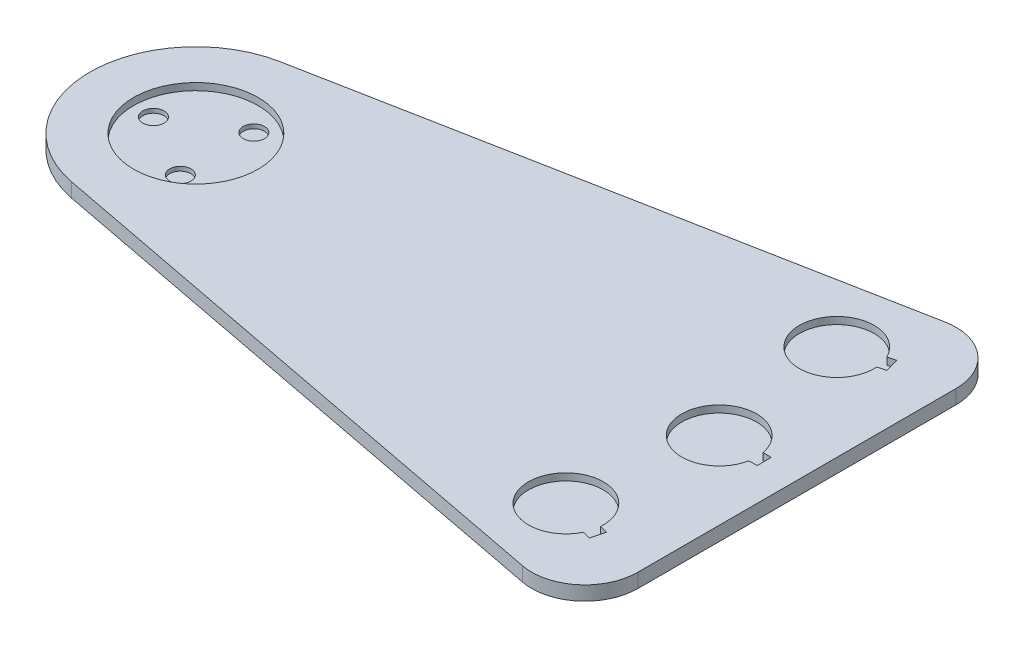
from build123d import *

# Parameters (mm, degrees)
IZIM2_W                        = 500
IZIM2_H                        = 300
Y_KSEKLIK_EKSTR_ZYON2_DEPTH    = 10
IZIM3_OUTSIDE_W                = 618.636
IZIM3_OUTSIDE_H                = 418.636
KES_EKSTR_ZYON1_DEPTH          = 10
TABAKLARI_UZAKLASTIRMA_2_DEPTH = 5
DAIRESEL_KAPLAMA1_COUNT        = 2
DAIRESEL_KAPLAMA1_ANGLE        = 15
AYNALAMA1_COPY_1_DEPTH         = 5
AYNALAMA1_COPY_2_DEPTH         = 5
IZIM9_R                        = 7.5
KES_EKSTR_ZYON4_DEPTH          = 8
DAIRESEL_KAPLAMA2_COUNT        = 3
IZIM10_R                       = 44
KES_EKSTR_ZYON5_DEPTH          = 5


with BuildPart() as part:
    # Çizim2 → Yükseklik-Ekstrüzyon2 (new body)
    with BuildSketch(Plane(origin=(0, 0, 0), x_dir=(1, 0, 0), z_dir=(0, 1, 0))):
        Rectangle(IZIM2_W, IZIM2_H)
    extrude(amount=Y_KSEKLIK_EKSTR_ZYON2_DEPTH)

    # Çizim3 outside → Kes-Ekstrüzyon1 (cut)
    with BuildSketch(Plane(origin=(0, 10, 0), x_dir=(1, 0, 0), z_dir=(0, 1, 0))):
        Rectangle(IZIM3_OUTSIDE_W, IZIM3_OUTSIDE_H)
        with BuildLine():
            Line((-189.1264052, 73.65761791), (205.4367974, 149.328808955))
            ThreePointArc((205.4367974, 149.328808955), (236.389117842, 141.406055572), (250, 112.5))
            Line((250, 112.5), (250, -112.5))
            ThreePointArc((250, -112.5), (236.389117842, -141.406055572), (205.4367974, -149.328808955))
            Line((205.4367974, -149.328808955), (-189.1264052, -73.65761791))
            ThreePointArc((-189.1264052, -73.65761791), (-250, 0), (-189.1264052, 73.65761791))
        make_face(mode=Mode.SUBTRACT)
    extrude(amount=-KES_EKSTR_ZYON1_DEPTH, mode=Mode.SUBTRACT)

    # Çizim6 → Tabaklari-uzaklastirma-2 (cut)
    with BuildSketch(Plane(origin=(0, 10, 0), x_dir=(1, 0, 0), z_dir=(0, 1, 0))):
        with BuildLine():
            Line((226.85, 5), (220.983294633, 5))
            ThreePointArc((220.983294633, 5), (221.340554056, 2.511336696), (221.46, 0))
            ThreePointArc((221.46, 0), (221.340554056, -2.511336696), (220.983294633, -5))
            Line((220.983294633, -5), (226.85, -5))
            Line((226.85, -5), (226.85, 5))
        make_face()
        with BuildLine():
            Line((206.85, -5), (206.85, 5))
            Line((206.85, 5), (220.983294633, 5))
            ThreePointArc((220.983294633, 5), (168.54, 0), (220.983294633, -5))
            Line((220.983294633, -5), (206.85, -5))
        make_face()
        with BuildLine():
            Line((220.983294633, 5), (206.85, 5))
            Line((206.85, 5), (206.85, -5))
            Line((206.85, -5), (220.983294633, -5))
            ThreePointArc((220.983294633, -5), (221.340554056, -2.511336696), (221.46, 0))
            ThreePointArc((221.46, 0), (221.340554056, 2.511336696), (220.983294633, 5))
        make_face()
    tabaklari_uzaklastirma_2 = extrude(amount=-TABAKLARI_UZAKLASTIRMA_2_DEPTH, mode=Mode.SUBTRACT)

    # Dairesel Kaplama1: Tabaklari-uzaklastirma-2 ×2 about axis
    dairesel_kaplama1_axis = Axis((-175, 0, 0), (0, 1, 0))
    for i in range(1, DAIRESEL_KAPLAMA1_COUNT):
        add(tabaklari_uzaklastirma_2.rotate(dairesel_kaplama1_axis, i * DAIRESEL_KAPLAMA1_ANGLE / (DAIRESEL_KAPLAMA1_COUNT - 1)), mode=Mode.SUBTRACT)

    # Aynalama1 copy 1 sketch → Aynalama1 copy 1 (cut)
    with BuildSketch(Plane(origin=(-5.962980399, 10, 45.293332893), x_dir=(0.9659258262890681, 0, 0.2588190451025214), z_dir=(0, 1, 0))):
        with BuildLine():
            Line((226.85, -5), (220.983294633, -5))
            ThreePointArc((220.983294633, -5), (221.340554056, -2.511336696), (221.46, 0))
            ThreePointArc((221.46, 0), (221.340554056, 2.511336696), (220.983294633, 5))
            Line((220.983294633, 5), (226.85, 5))
            Line((226.85, 5), (226.85, -5))
        make_face()
        with BuildLine():
            Line((206.85, 5), (206.85, -5))
            Line((206.85, -5), (220.983294633, -5))
            ThreePointArc((220.983294633, -5), (168.54, 0), (220.983294633, 5))
            Line((220.983294633, 5), (206.85, 5))
        make_face()
        with BuildLine():
            Line((220.983294633, -5), (206.85, -5))
            Line((206.85, -5), (206.85, 5))
            Line((206.85, 5), (220.983294633, 5))
            ThreePointArc((220.983294633, 5), (221.340554056, 2.511336696), (221.46, 0))
            ThreePointArc((221.46, 0), (221.340554056, -2.511336696), (220.983294633, -5))
        make_face()
    extrude(amount=-AYNALAMA1_COPY_1_DEPTH, mode=Mode.SUBTRACT)

    # Aynalama1 copy 2 sketch → Aynalama1 copy 2 (cut)
    with BuildSketch(Plane(origin=(0, 10, 0), x_dir=(1, 0, 0), z_dir=(0, 1, 0))):
        with BuildLine():
            Line((226.85, -5), (220.983294633, -5))
            ThreePointArc((220.983294633, -5), (221.340554056, -2.511336696), (221.46, 0))
            ThreePointArc((221.46, 0), (221.340554056, 2.511336696), (220.983294633, 5))
            Line((220.983294633, 5), (226.85, 5))
            Line((226.85, 5), (226.85, -5))
        make_face()
        with BuildLine():
            Line((206.85, 5), (206.85, -5))
            Line((206.85, -5), (220.983294633, -5))
            ThreePointArc((220.983294633, -5), (168.54, 0), (220.983294633, 5))
            Line((220.983294633, 5), (206.85, 5))
        make_face()
        with BuildLine():
            Line((220.983294633, -5), (206.85, -5))
            Line((206.85, -5), (206.85, 5))
            Line((206.85, 5), (220.983294633, 5))
            ThreePointArc((220.983294633, 5), (221.340554056, 2.511336696), (221.46, 0))
            ThreePointArc((221.46, 0), (221.340554056, -2.511336696), (220.983294633, -5))
        make_face()
    extrude(amount=-AYNALAMA1_COPY_2_DEPTH, mode=Mode.SUBTRACT)

    # Çizim9 → Kes-Ekstrüzyon4 (cut)
    with BuildSketch(Plane(origin=(0, 10, 0), x_dir=(1, 0, 0), z_dir=(0, 1, 0))):
        with Locations(Location((-205, 0, 0), (0, 0, 270))):
            Circle(IZIM9_R)
    kes_ekstr_zyon4 = extrude(amount=-KES_EKSTR_ZYON4_DEPTH, mode=Mode.SUBTRACT)

    # Dairesel Kaplama2: Kes-Ekstrüzyon4 ×3 about axis
    dairesel_kaplama2_axis = Axis((-175, 0, 0), (0, 1, 0))
    for i in range(1, DAIRESEL_KAPLAMA2_COUNT):
        add(kes_ekstr_zyon4.rotate(dairesel_kaplama2_axis, i * 360 / DAIRESEL_KAPLAMA2_COUNT), mode=Mode.SUBTRACT)

    # Çizim10 → Kes-Ekstrüzyon5 (cut)
    with BuildSketch(Plane(origin=(0, 10, 0), x_dir=(1, 0, 0), z_dir=(0, 1, 0))):
        with Locations(Location((-175, 0, 0), (0, 0, 270))):
            Circle(IZIM10_R)
    extrude(amount=-KES_EKSTR_ZYON5_DEPTH, mode=Mode.SUBTRACT)


solid = part.part
